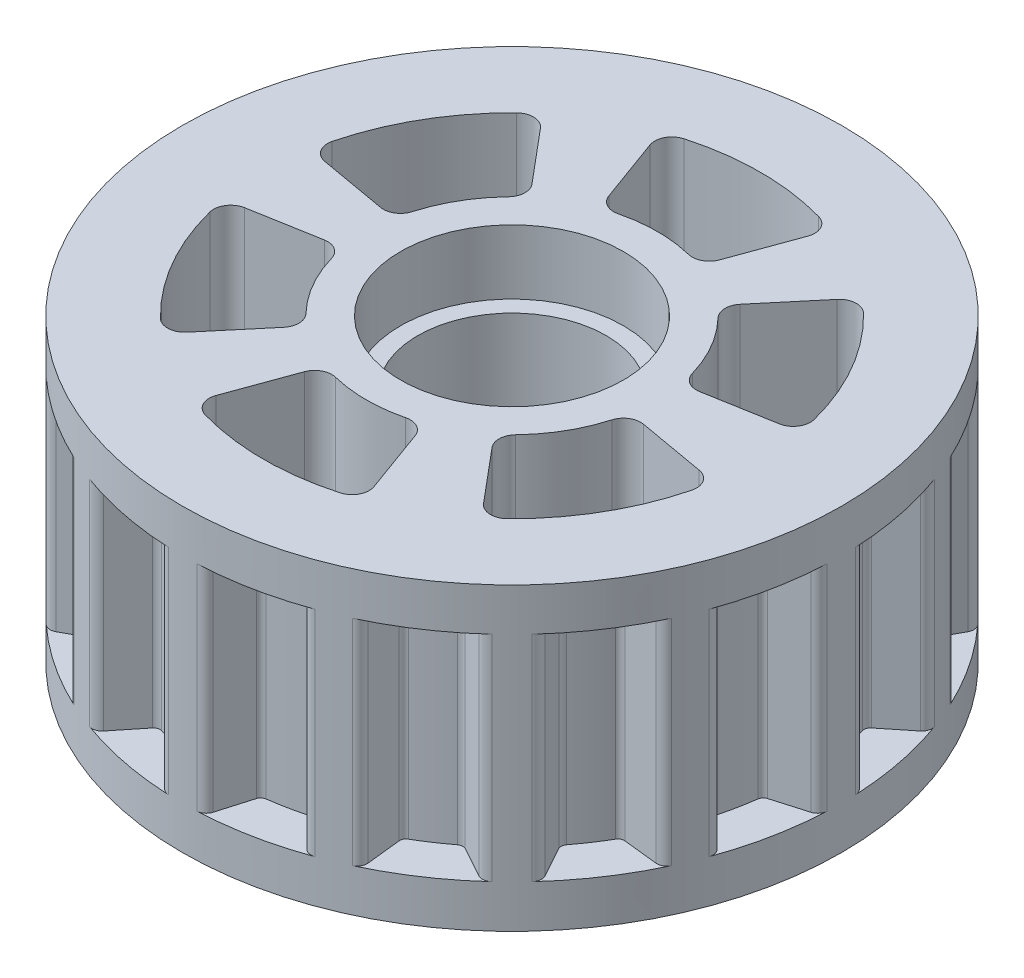
from build123d import *
from build123d.topology import SkipClean

# Parameters (mm, degrees)
SKETCH_1_R          = 76.925
EXTRUDE_1_DEPTH     = 10
EXTRUDE_2_DEPTH     = 50
SKETCH_3_R          = 76.925
EXTRUDE_3_DEPTH     = 10
SKETCH_4_R          = 26
CUT_EXTRUDE_1_DEPTH = 15
SKETCH_5_R          = 22
CUT_EXTRUDE_2_DEPTH = 40
SKETCH_6_R          = 26
CUT_EXTRUDE_3_DEPTH = 122.901235638
CUT_EXTRUDE_4_DEPTH = 130.363484995


with BuildPart() as part:
    # 草图1 → 凸台-拉伸1 (new body)
    with BuildSketch(Plane(origin=(0, 0, 0), x_dir=(1, 0, 0), z_dir=(0, 1, 0))):
        with Locations(Location((0, 0, 0), (0, 0, 270))):
            Circle(SKETCH_1_R)
    extrude(amount=EXTRUDE_1_DEPTH)

    # 草图2 → 凸台-拉伸2 (add)
    with SkipClean():  # the faces are left unmerged after this step: merging them gives an invalid solid
        with BuildSketch(Plane(origin=(0, 10, 0), x_dir=(1, 0, 0), z_dir=(0, 1, 0))):
            with BuildLine():
                Line((5.447555668, 75.199403588), (7.728981055, 67.387415578))
                ThreePointArc((7.728981055, 67.387415578), (8.190482824, 66.670888291), (8.967838365, 66.321440727))
                ThreePointArc((8.967838365, 66.321440727), (13.056419801, 65.639054891), (17.094914261, 64.70486482))
                ThreePointArc((17.094914261, 64.70486482), (17.946824927, 64.730231186), (18.647400087, 65.215607))
                Line((18.647400087, 65.215607), (23.744680693, 71.559879134))
                ThreePointArc((23.744680693, 71.559879134), (24.918986332, 72.334545637), (26.324751361, 72.2804475))
                ThreePointArc((26.324751361, 72.2804475), (29.437923035, 71.069433038), (32.495584374, 69.724404775))
                ThreePointArc((32.495584374, 69.724404775), (33.527863518, 68.76863195), (33.810451061, 67.390500531))
                Line((33.810451061, 67.390500531), (32.928694896, 59.300101002))
                ThreePointArc((32.928694896, 59.300101002), (33.080863813, 58.461507026), (33.665318893, 57.841178488))
                ThreePointArc((33.665318893, 57.841178488), (37.181537845, 55.646103803), (40.555121156, 53.237559796))
                ThreePointArc((40.555121156, 53.237559796), (41.351891272, 52.934983164), (42.184883606, 53.115313438))
                Line((42.184883606, 53.115313438), (49.322004665, 57.026011773))
                ThreePointArc((49.322004665, 57.026011773), (50.703373646, 57.292322987), (51.981428723, 56.704379839))
                ThreePointArc((51.981428723, 56.704379839), (54.394189143, 54.394189143), (56.704379839, 51.981428723))
                ThreePointArc((56.704379839, 51.981428723), (57.292322987, 50.703373646), (57.026011773, 49.322004665))
                Line((57.026011773, 49.322004665), (53.115313438, 42.184883606))
                ThreePointArc((53.115313438, 42.184883606), (52.934983164, 41.351891272), (53.237559796, 40.555121156))
                ThreePointArc((53.237559796, 40.555121156), (55.646103803, 37.181537845), (57.841178488, 33.665318893))
                ThreePointArc((57.841178488, 33.665318893), (58.461507026, 33.080863813), (59.300101002, 32.928694896))
                Line((59.300101002, 32.928694896), (67.390500531, 33.810451061))
                ThreePointArc((67.390500531, 33.810451061), (68.76863195, 33.527863518), (69.724404775, 32.495584374))
                ThreePointArc((69.724404775, 32.495584374), (71.069433038, 29.437923035), (72.2804475, 26.324751361))
                ThreePointArc((72.2804475, 26.324751361), (72.334545637, 24.918986332), (71.559879134, 23.744680693))
                Line((71.559879134, 23.744680693), (65.215607, 18.647400087))
                ThreePointArc((65.215607, 18.647400087), (64.730231186, 17.946824927), (64.70486482, 17.094914261))
                ThreePointArc((64.70486482, 17.094914261), (65.639054891, 13.056419801), (66.321440727, 8.967838365))
                ThreePointArc((66.321440727, 8.967838365), (66.670888291, 8.190482824), (67.387415578, 7.728981055))
                Line((67.387415578, 7.728981055), (75.199403588, 5.447555668))
                ThreePointArc((75.199403588, 5.447555668), (76.364489428, 4.65909076), (76.852472253, 3.339630761))
                ThreePointArc((76.852472253, 3.339630761), (76.925, 0), (76.852472253, -3.339630761))
                ThreePointArc((76.852472253, -3.339630761), (76.364489428, -4.65909076), (75.199403588, -5.447555668))
                Line((75.199403588, -5.447555668), (67.387415578, -7.728981055))
                ThreePointArc((67.387415578, -7.728981055), (66.670888291, -8.190482824), (66.321440727, -8.967838365))
                ThreePointArc((66.321440727, -8.967838365), (65.639054891, -13.056419801), (64.70486482, -17.094914261))
                ThreePointArc((64.70486482, -17.094914261), (64.730231186, -17.946824927), (65.215607, -18.647400087))
                Line((65.215607, -18.647400087), (71.559879134, -23.744680693))
                ThreePointArc((71.559879134, -23.744680693), (72.334545637, -24.918986332), (72.2804475, -26.324751361))
                ThreePointArc((72.2804475, -26.324751361), (71.069433038, -29.437923035), (69.724404775, -32.495584374))
                ThreePointArc((69.724404775, -32.495584374), (68.76863195, -33.527863518), (67.390500531, -33.810451061))
                Line((67.390500531, -33.810451061), (59.300101002, -32.928694896))
                ThreePointArc((59.300101002, -32.928694896), (58.461507026, -33.080863813), (57.841178488, -33.665318893))
                ThreePointArc((57.841178488, -33.665318893), (55.646103803, -37.181537845), (53.237559796, -40.555121156))
                ThreePointArc((53.237559796, -40.555121156), (52.934983164, -41.351891272), (53.115313438, -42.184883606))
                Line((53.115313438, -42.184883606), (57.026011773, -49.322004665))
                ThreePointArc((57.026011773, -49.322004665), (57.292322987, -50.703373646), (56.704379839, -51.981428723))
                ThreePointArc((56.704379839, -51.981428723), (54.394189143, -54.394189143), (51.981428723, -56.704379839))
                ThreePointArc((51.981428723, -56.704379839), (50.703373646, -57.292322987), (49.322004665, -57.026011773))
                Line((49.322004665, -57.026011773), (42.184883606, -53.115313438))
                ThreePointArc((42.184883606, -53.115313438), (41.351891272, -52.934983164), (40.555121156, -53.237559796))
                ThreePointArc((40.555121156, -53.237559796), (37.181537845, -55.646103803), (33.665318893, -57.841178488))
                ThreePointArc((33.665318893, -57.841178488), (33.080863813, -58.461507026), (32.928694896, -59.300101002))
                Line((32.928694896, -59.300101002), (33.810451061, -67.390500531))
                ThreePointArc((33.810451061, -67.390500531), (33.527863518, -68.76863195), (32.495584374, -69.724404775))
                ThreePointArc((32.495584374, -69.724404775), (29.437923035, -71.069433038), (26.324751361, -72.2804475))
                ThreePointArc((26.324751361, -72.2804475), (24.918986332, -72.334545637), (23.744680693, -71.559879134))
                Line((23.744680693, -71.559879134), (18.647400087, -65.215607))
                ThreePointArc((18.647400087, -65.215607), (17.946824927, -64.730231186), (17.094914261, -64.70486482))
                ThreePointArc((17.094914261, -64.70486482), (13.056419801, -65.639054891), (8.967838365, -66.321440727))
                ThreePointArc((8.967838365, -66.321440727), (8.190482824, -66.670888291), (7.728981055, -67.387415578))
                Line((7.728981055, -67.387415578), (5.447555668, -75.199403588))
                ThreePointArc((5.447555668, -75.199403588), (4.65909076, -76.364489428), (3.339630761, -76.852472253))
                ThreePointArc((3.339630761, -76.852472253), (0, -76.925), (-3.339630761, -76.852472253))
                ThreePointArc((-3.339630761, -76.852472253), (-4.65909076, -76.364489428), (-5.447555668, -75.199403588))
                Line((-5.447555668, -75.199403588), (-7.728981055, -67.387415578))
                ThreePointArc((-7.728981055, -67.387415578), (-8.190482824, -66.670888291), (-8.967838365, -66.321440727))
                ThreePointArc((-8.967838365, -66.321440727), (-13.056419801, -65.639054891), (-17.094914261, -64.70486482))
                ThreePointArc((-17.094914261, -64.70486482), (-17.946824927, -64.730231186), (-18.647400087, -65.215607))
                Line((-18.647400087, -65.215607), (-23.744680693, -71.559879134))
                ThreePointArc((-23.744680693, -71.559879134), (-24.918986332, -72.334545637), (-26.324751361, -72.2804475))
                ThreePointArc((-26.324751361, -72.2804475), (-29.437923035, -71.069433038), (-32.495584374, -69.724404775))
                ThreePointArc((-32.495584374, -69.724404775), (-33.527863518, -68.76863195), (-33.810451061, -67.390500531))
                Line((-33.810451061, -67.390500531), (-32.928694896, -59.300101002))
                ThreePointArc((-32.928694896, -59.300101002), (-33.080863813, -58.461507026), (-33.665318893, -57.841178488))
                ThreePointArc((-33.665318893, -57.841178488), (-37.181537845, -55.646103803), (-40.555121156, -53.237559796))
                ThreePointArc((-40.555121156, -53.237559796), (-41.351891272, -52.934983164), (-42.184883606, -53.115313438))
                Line((-42.184883606, -53.115313438), (-49.322004665, -57.026011773))
                ThreePointArc((-49.322004665, -57.026011773), (-50.703373646, -57.292322987), (-51.981428723, -56.704379839))
                ThreePointArc((-51.981428723, -56.704379839), (-54.394189143, -54.394189143), (-56.704379839, -51.981428723))
                ThreePointArc((-56.704379839, -51.981428723), (-57.292322987, -50.703373646), (-57.026011773, -49.322004665))
                Line((-57.026011773, -49.322004665), (-53.115313438, -42.184883606))
                ThreePointArc((-53.115313438, -42.184883606), (-52.934983164, -41.351891272), (-53.237559796, -40.555121156))
                ThreePointArc((-53.237559796, -40.555121156), (-55.646103803, -37.181537845), (-57.841178488, -33.665318893))
                ThreePointArc((-57.841178488, -33.665318893), (-58.461507026, -33.080863812), (-59.300101002, -32.928694896))
                Line((-59.300101002, -32.928694896), (-67.390500531, -33.810451061))
                ThreePointArc((-67.390500531, -33.810451061), (-68.76863195, -33.527863518), (-69.724404775, -32.495584374))
                ThreePointArc((-69.724404775, -32.495584374), (-71.069433038, -29.437923035), (-72.2804475, -26.324751361))
                ThreePointArc((-72.2804475, -26.324751361), (-72.334545637, -24.918986332), (-71.559879134, -23.744680693))
                Line((-71.559879134, -23.744680693), (-65.215607, -18.647400087))
                ThreePointArc((-65.215607, -18.647400087), (-64.730231186, -17.946824927), (-64.70486482, -17.094914261))
                ThreePointArc((-64.70486482, -17.094914261), (-65.639054891, -13.056419801), (-66.321440727, -8.967838365))
                ThreePointArc((-66.321440727, -8.967838365), (-66.670888291, -8.190482824), (-67.387415578, -7.728981055))
                Line((-67.387415578, -7.728981055), (-75.199403588, -5.447555668))
                ThreePointArc((-75.199403588, -5.447555668), (-76.364489428, -4.65909076), (-76.852472253, -3.339630761))
                ThreePointArc((-76.852472253, -3.339630761), (-76.925, 0), (-76.852472253, 3.339630761))
                ThreePointArc((-76.852472253, 3.339630761), (-76.364489428, 4.65909076), (-75.199403588, 5.447555668))
                Line((-75.199403588, 5.447555668), (-67.387415578, 7.728981055))
                ThreePointArc((-67.387415578, 7.728981055), (-66.670888291, 8.190482824), (-66.321440727, 8.967838365))
                ThreePointArc((-66.321440727, 8.967838365), (-65.639054891, 13.056419801), (-64.70486482, 17.094914261))
                ThreePointArc((-64.70486482, 17.094914261), (-64.730231186, 17.946824927), (-65.215607, 18.647400087))
                Line((-65.215607, 18.647400087), (-71.559879134, 23.744680693))
                ThreePointArc((-71.559879134, 23.744680693), (-72.334545637, 24.918986332), (-72.2804475, 26.324751361))
                ThreePointArc((-72.2804475, 26.324751361), (-71.069433038, 29.437923035), (-69.724404775, 32.495584374))
                ThreePointArc((-69.724404775, 32.495584374), (-68.76863195, 33.527863518), (-67.390500531, 33.810451061))
                Line((-67.390500531, 33.810451061), (-59.300101002, 32.928694896))
                ThreePointArc((-59.300101002, 32.928694896), (-58.461507026, 33.080863813), (-57.841178488, 33.665318893))
                ThreePointArc((-57.841178488, 33.665318893), (-55.646103803, 37.181537845), (-53.237559796, 40.555121156))
                ThreePointArc((-53.237559796, 40.555121156), (-52.934983164, 41.351891272), (-53.115313438, 42.184883606))
                Line((-53.115313438, 42.184883606), (-57.026011773, 49.322004665))
                ThreePointArc((-57.026011773, 49.322004665), (-57.292322987, 50.703373646), (-56.704379839, 51.981428723))
                ThreePointArc((-56.704379839, 51.981428723), (-54.394189143, 54.394189143), (-51.981428723, 56.704379839))
                ThreePointArc((-51.981428723, 56.704379839), (-50.703373646, 57.292322987), (-49.322004665, 57.026011773))
                Line((-49.322004665, 57.026011773), (-42.184883606, 53.115313438))
                ThreePointArc((-42.184883606, 53.115313438), (-41.351891272, 52.934983164), (-40.555121156, 53.237559796))
                ThreePointArc((-40.555121156, 53.237559796), (-37.181537845, 55.646103803), (-33.665318893, 57.841178488))
                ThreePointArc((-33.665318893, 57.841178488), (-33.080863812, 58.461507026), (-32.928694896, 59.300101002))
                Line((-32.928694896, 59.300101002), (-33.810451061, 67.390500531))
                ThreePointArc((-33.810451061, 67.390500531), (-33.527863518, 68.76863195), (-32.495584374, 69.724404775))
                ThreePointArc((-32.495584374, 69.724404775), (-29.437923035, 71.069433038), (-26.324751361, 72.2804475))
                ThreePointArc((-26.324751361, 72.2804475), (-24.918986332, 72.334545637), (-23.744680693, 71.559879134))
                Line((-23.744680693, 71.559879134), (-18.647400087, 65.215607))
                ThreePointArc((-18.647400087, 65.215607), (-17.946824927, 64.730231186), (-17.094914261, 64.70486482))
                ThreePointArc((-17.094914261, 64.70486482), (-13.056419801, 65.639054891), (-8.967838365, 66.321440727))
                ThreePointArc((-8.967838365, 66.321440727), (-8.190482824, 66.670888291), (-7.728981055, 67.387415578))
                Line((-7.728981055, 67.387415578), (-5.447555668, 75.199403588))
                ThreePointArc((-5.447555668, 75.199403588), (-4.65909076, 76.364489428), (-3.339630761, 76.852472253))
                ThreePointArc((-3.339630761, 76.852472253), (0, 76.925), (3.339630761, 76.852472253))
                ThreePointArc((3.339630761, 76.852472253), (4.65909076, 76.364489428), (5.447555668, 75.199403588))
            make_face()
        extrude(amount=EXTRUDE_2_DEPTH)

    # 草图3 → 凸台-拉伸3 (add)
    with SkipClean():  # the faces are left unmerged after this step: merging them gives an invalid solid
        with BuildSketch(Plane(origin=(0, 60, 0), x_dir=(1, 0, 0), z_dir=(0, 1, 0))):
            with Locations(Location((0, 0, 0), (0, 0, 270))):
                Circle(SKETCH_3_R)
        extrude(amount=EXTRUDE_3_DEPTH)

    # 草图4 → 切除-拉伸1 (cut)
    with SkipClean():  # the faces are left unmerged after this step: merging them gives an invalid solid
        with BuildSketch(Plane(origin=(0, 0, 0), x_dir=(1, 0, 0), z_dir=(0, 1, 0))):
            with Locations(Location((0, 0, 0), (0, 0, 270))):
                Circle(SKETCH_4_R)
        extrude(amount=CUT_EXTRUDE_1_DEPTH, mode=Mode.SUBTRACT)

    # 草图5 → 切除-拉伸2 (cut)
    with SkipClean():  # the faces are left unmerged after this step: merging them gives an invalid solid
        with BuildSketch(Plane(origin=(0, 15, 0), x_dir=(-1, 0, 0), z_dir=(0, -1, 0))):
            with Locations(Location((0, 0, 0), (0, 0, 90))):
                Circle(SKETCH_5_R)
        extrude(amount=-CUT_EXTRUDE_2_DEPTH, mode=Mode.SUBTRACT)

    # 草图6 → 切除-拉伸3 (cut, through all)
    with SkipClean():  # the faces are left unmerged after this step: merging them gives an invalid solid
        with BuildSketch(Plane(origin=(0, 55, 0), x_dir=(-1, 0, 0), z_dir=(0, -1, 0))):
            with Locations(Location((0, 0, 0), (0, 0, 270))):
                Circle(SKETCH_6_R)
        extrude(amount=-CUT_EXTRUDE_3_DEPTH, mode=Mode.SUBTRACT)

    # 草图7 → 切除-拉伸4 (cut, through all)
    with SkipClean():  # the faces are left unmerged after this step: merging them gives an invalid solid
        with BuildSketch(Plane(origin=(0, 0, 0), x_dir=(1, 0, 0), z_dir=(0, 1, 0))):
            with BuildLine():
                Line((12.924560635, 35.509938502), (18.418348392, 50.60399631))
                ThreePointArc((18.418348392, 50.60399631), (18.219665181, 53.795748622), (15.745472568, 55.821860356))
                ThreePointArc((15.745472568, 55.821860356), (0, 58), (-15.745472568, 55.821860356))
                ThreePointArc((-15.745472568, 55.821860356), (-18.219665181, 53.795748622), (-18.418348392, 50.60399631))
                Line((-18.418348392, 50.60399631), (-12.924560635, 35.509938502))
                ThreePointArc((-12.924560635, 35.509938502), (-11.044980866, 33.346922608), (-8.200970136, 32.99612233))
                ThreePointArc((-8.200970136, 32.99612233), (0, 34), (8.200970136, 32.99612233))
                ThreePointArc((8.200970136, 32.99612233), (11.044980866, 33.346922608), (12.924560635, 35.509938502))
            make_face()
            with BuildLine():
                Line((37.214789147, 6.561971408), (53.033520533, 9.351240552))
                ThreePointArc((53.033520533, 9.351240552), (55.698317513, 11.119181416), (56.215885439, 14.274950939))
                ThreePointArc((56.215885439, 14.274950939), (50.229473419, 29), (40.470412871, 41.546909417))
                ThreePointArc((40.470412871, 41.546909417), (37.478652332, 42.676567206), (34.615172141, 41.252755758))
                Line((34.615172141, 41.252755758), (24.290228512, 28.947967094))
                ThreePointArc((24.290228512, 28.947967094), (23.356791683, 26.238695318), (24.474995096, 23.600309639))
                ThreePointArc((24.474995096, 23.600309639), (29.444863729, 17), (32.675965232, 9.395812692))
                ThreePointArc((32.675965232, 9.395812692), (34.401772549, 7.10822729), (37.214789147, 6.561971408))
            make_face()
            with BuildLine():
                Line((24.290228512, -28.947967094), (34.615172141, -41.252755758))
                ThreePointArc((34.615172141, -41.252755758), (37.478652332, -42.676567206), (40.470412871, -41.546909417))
                ThreePointArc((40.470412871, -41.546909417), (50.229473419, -29), (56.215885439, -14.274950939))
                ThreePointArc((56.215885439, -14.274950939), (55.698317513, -11.119181416), (53.033520533, -9.351240552))
                Line((53.033520533, -9.351240552), (37.214789147, -6.561971408))
                ThreePointArc((37.214789147, -6.561971408), (34.401772549, -7.10822729), (32.675965232, -9.395812692))
                ThreePointArc((32.675965232, -9.395812692), (29.444863729, -17), (24.474995096, -23.600309639))
                ThreePointArc((24.474995096, -23.600309639), (23.356791683, -26.238695318), (24.290228512, -28.947967094))
            make_face()
            with BuildLine():
                Line((-12.924560635, -35.509938502), (-18.418348392, -50.60399631))
                ThreePointArc((-18.418348392, -50.60399631), (-18.219665181, -53.795748622), (-15.745472568, -55.821860356))
                ThreePointArc((-15.745472568, -55.821860356), (0, -58), (15.745472568, -55.821860356))
                ThreePointArc((15.745472568, -55.821860356), (18.219665181, -53.795748622), (18.418348392, -50.60399631))
                Line((18.418348392, -50.60399631), (12.924560635, -35.509938502))
                ThreePointArc((12.924560635, -35.509938502), (11.044980866, -33.346922608), (8.200970136, -32.99612233))
                ThreePointArc((8.200970136, -32.99612233), (0, -34), (-8.200970136, -32.99612233))
                ThreePointArc((-8.200970136, -32.99612233), (-11.044980866, -33.346922608), (-12.924560635, -35.509938502))
            make_face()
            with BuildLine():
                Line((-37.214789147, -6.561971408), (-53.033520533, -9.351240552))
                ThreePointArc((-53.033520533, -9.351240552), (-55.698317513, -11.119181416), (-56.215885439, -14.274950939))
                ThreePointArc((-56.215885439, -14.274950939), (-50.229473419, -29), (-40.470412871, -41.546909417))
                ThreePointArc((-40.470412871, -41.546909417), (-37.478652332, -42.676567206), (-34.615172141, -41.252755758))
                Line((-34.615172141, -41.252755758), (-24.290228512, -28.947967094))
                ThreePointArc((-24.290228512, -28.947967094), (-23.356791683, -26.238695318), (-24.474995096, -23.600309639))
                ThreePointArc((-24.474995096, -23.600309639), (-29.444863729, -17), (-32.675965232, -9.395812692))
                ThreePointArc((-32.675965232, -9.395812692), (-34.401772549, -7.10822729), (-37.214789147, -6.561971408))
            make_face()
            with BuildLine():
                Line((-24.290228512, 28.947967094), (-34.615172141, 41.252755758))
                ThreePointArc((-34.615172141, 41.252755758), (-37.478652332, 42.676567206), (-40.470412871, 41.546909417))
                ThreePointArc((-40.470412871, 41.546909417), (-50.229473419, 29), (-56.215885439, 14.274950939))
                ThreePointArc((-56.215885439, 14.274950939), (-55.698317513, 11.119181416), (-53.033520533, 9.351240552))
                Line((-53.033520533, 9.351240552), (-37.214789147, 6.561971408))
                ThreePointArc((-37.214789147, 6.561971408), (-34.401772549, 7.10822729), (-32.675965232, 9.395812692))
                ThreePointArc((-32.675965232, 9.395812692), (-29.444863729, 17), (-24.474995096, 23.600309639))
                ThreePointArc((-24.474995096, 23.600309639), (-23.356791683, 26.238695318), (-24.290228512, 28.947967094))
            make_face()
        extrude(amount=CUT_EXTRUDE_4_DEPTH, mode=Mode.SUBTRACT)


solid = part.part
